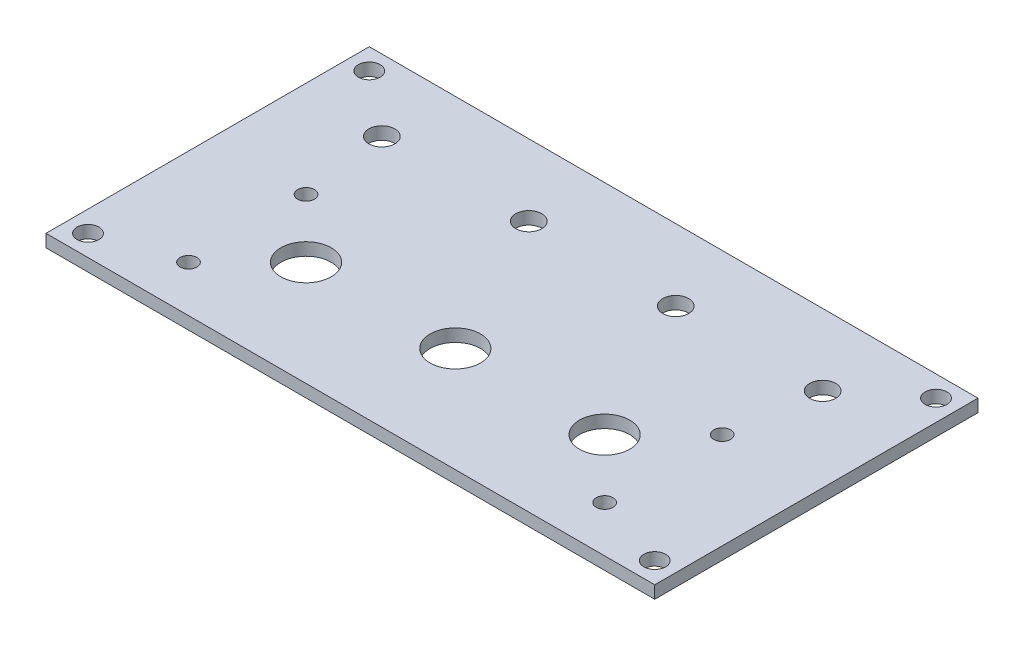
from build123d import *

# Parameters (mm, degrees)
SKETCH1_W           = 145
SKETCH1_H           = 77
SKETCH1_R           = 3.1
SKETCH1_R_2         = 2.6
SKETCH1_R_3         = 6
SKETCH1_R_4         = 2
BOSS_EXTRUDE1_DEPTH = 3


with BuildPart() as part:
    # Sketch1 → Boss-Extrude1 (new body)
    with BuildSketch(Plane(origin=(0, 0, 0), x_dir=(1, 0, 0), z_dir=(0, 1, 0))):
        with Locations((72.5, 38.5)):
            Rectangle(SKETCH1_W, SKETCH1_H)
        with Locations(Location((20, 60, 0), (0, 0, 270))):
            Circle(SKETCH1_R, mode=Mode.SUBTRACT)
        with Locations(Location((55, 60, 0), (0, 0, 270))):
            Circle(SKETCH1_R, mode=Mode.SUBTRACT)
        with Locations(Location((90, 60, 0), (0, 0, 270))):
            Circle(SKETCH1_R, mode=Mode.SUBTRACT)
        with Locations(Location((125, 60, 0), (0, 0, 270))):
            Circle(SKETCH1_R, mode=Mode.SUBTRACT)
        with Locations(Location((5, 72, 0), (0, 0, 270))):
            Circle(SKETCH1_R_2, mode=Mode.SUBTRACT)
        with Locations(Location((5, 5, 0), (0, 0, 270))):
            Circle(SKETCH1_R_2, mode=Mode.SUBTRACT)
        with Locations(Location((140, 5, 0), (0, 0, 270))):
            Circle(SKETCH1_R_2, mode=Mode.SUBTRACT)
        with Locations(Location((140, 72, 0), (0, 0, 270))):
            Circle(SKETCH1_R_2, mode=Mode.SUBTRACT)
        with Locations(Location((36.94, 25, 0), (0, 0, 270))):
            Circle(SKETCH1_R_3, mode=Mode.SUBTRACT)
        with Locations(Location((72.5, 25, 0), (0, 0, 270))):
            Circle(SKETCH1_R_3, mode=Mode.SUBTRACT)
        with Locations(Location((108.06, 25, 0), (0, 0, 270))):
            Circle(SKETCH1_R_3, mode=Mode.SUBTRACT)
        with Locations(Location((22.94, 39, 0), (0, 0, 270))):
            Circle(SKETCH1_R_4, mode=Mode.SUBTRACT)
        with Locations(Location((122.06, 39, 0), (0, 0, 270))):
            Circle(SKETCH1_R_4, mode=Mode.SUBTRACT)
        with Locations(Location((122.06, 11, 0), (0, 0, 270))):
            Circle(SKETCH1_R_4, mode=Mode.SUBTRACT)
        with Locations(Location((22.94, 11, 0), (0, 0, 270))):
            Circle(SKETCH1_R_4, mode=Mode.SUBTRACT)
    extrude(amount=BOSS_EXTRUDE1_DEPTH)


solid = part.part
